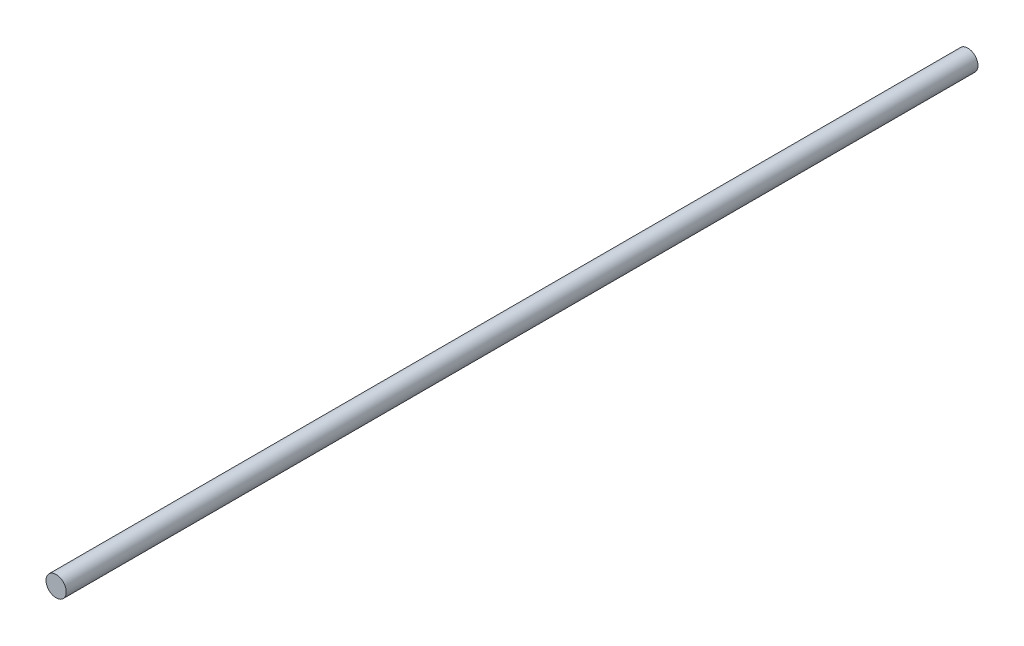
from build123d import *

# Parameters (mm, degrees)
SKETCH1_R           = 10
BOSS_EXTRUDE1_DEPTH = 900


with BuildPart() as part:
    # Sketch1 → Boss-Extrude1 (new body)
    with BuildSketch(Plane.XY):
        Circle(SKETCH1_R)
    extrude(amount=BOSS_EXTRUDE1_DEPTH)


solid = part.part
